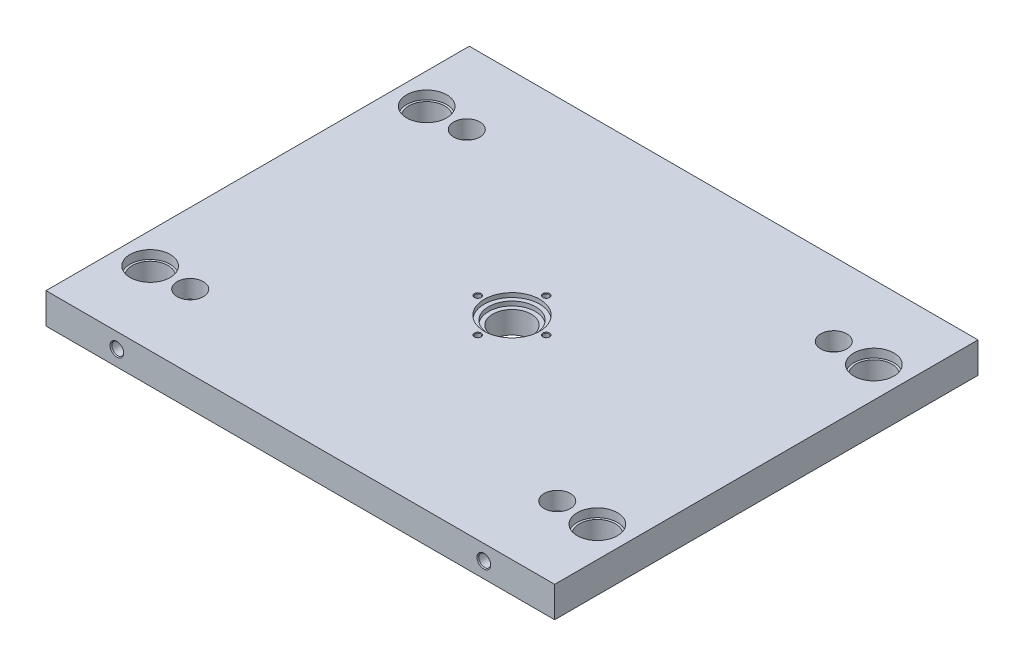
from build123d import *

# Parameters (mm, degrees)
SZKIC1_W                                           = 596
SZKIC1_H                                           = 496
SZKIC1_R                                           = 21
DODANIE_WYCI_GNI_CIE1_DEPTH                        = 36
POG_BIENIE_WALCOWE_POD_M16_WKR_T_Z_BEM_D           = 17.5
POG_BIENIE_WALCOWE_POD_M16_WKR_T_Z_BEM_CBORE_D     = 30.713
POG_BIENIE_WALCOWE_POD_M16_WKR_T_Z_BEM_CBORE_DEPTH = 21
SZKIC8_R                                           = 23.5
WYTNIJ_WYCI_GNI_CIE1_DEPTH                         = 10
SZKIC10_R                                          = 22.5
WYTNIJ_WYCI_GNI_CIE3_DEPTH                         = 777.226770989
SZKIC10_3_R                                        = 27.5
SZKIC10_3_R_2                                      = 22.5
WYTNIJ_WYCI_GNI_CIE4_DEPTH                         = 10
SZKIC10_4_R                                        = 32.5
SZKIC10_4_R_2                                      = 27.5
WYTNIJ_WYCI_GNI_CIE5_DEPTH                         = 5
OTW_R_GWINTOWANY_M161_D                            = 14
OTW_R_GWINTOWANY_M161_DEPTH                        = 42
OTW_R_GWINTOWANY_M161_CSINK_D                      = 16.05
OTW_R_GWINTOWANY_M161_CSINK_ANGLE                  = 90
OTW_R_GWINTOWANY_M161_TIP                          = 4.206024333
OTW_R_GWINTOWANY_M81_D                             = 6.8
OTW_R_GWINTOWANY_M81_DEPTH                         = 22.25
OTW_R_GWINTOWANY_M81_CSINK_D                       = 8.05
OTW_R_GWINTOWANY_M81_CSINK_ANGLE                   = 90
OTW_R_GWINTOWANY_M81_TIP                           = 2.042926105


with BuildPart() as part:
    # Szkic1 → Dodanie-wyciągnięcie1 (new body)
    with BuildSketch(Plane(origin=(0, 0, 0), x_dir=(1, 0, 0), z_dir=(0, 1, 0))):
        with Locations((298, 248)):
            Rectangle(SZKIC1_W, SZKIC1_H)
        with Locations((36, 86)):
            Circle(SZKIC1_R, mode=Mode.SUBTRACT)
        with Locations((560, 86)):
            Circle(SZKIC1_R, mode=Mode.SUBTRACT)
        with Locations((36, 410)):
            Circle(SZKIC1_R, mode=Mode.SUBTRACT)
        with Locations((560, 410)):
            Circle(SZKIC1_R, mode=Mode.SUBTRACT)
    extrude(amount=-DODANIE_WYCI_GNI_CIE1_DEPTH)

    # Pogłębienie walcowe pod M16 Wkręt z łbem sześciokątnym z gniazdem2 (through all)
    with Locations(Plane(origin=(83, 0, -410), x_dir=(0, 0, 1), z_dir=(0, 1, 0))):
        with Locations((0, 0), (0, 430), (324, 430), (324, 0)):
            CounterBoreHole(POG_BIENIE_WALCOWE_POD_M16_WKR_T_Z_BEM_D / 2, POG_BIENIE_WALCOWE_POD_M16_WKR_T_Z_BEM_CBORE_D / 2, POG_BIENIE_WALCOWE_POD_M16_WKR_T_Z_BEM_CBORE_DEPTH)

    # Szkic8 → Wytnij-wyciągnięcie1 (cut)
    with BuildSketch(Plane(origin=(0, 0, 0), x_dir=(1, 0, 0), z_dir=(0, 1, 0))):
        with Locations((36, 410)):
            Circle(SZKIC8_R)
        with Locations((560, 410)):
            Circle(SZKIC8_R)
        with Locations((560, 86)):
            Circle(SZKIC8_R)
        with Locations((36, 86)):
            Circle(SZKIC8_R)
    extrude(amount=-WYTNIJ_WYCI_GNI_CIE1_DEPTH, mode=Mode.SUBTRACT)

    # Szkic10 → Wytnij-wyciągnięcie3 (cut, through all)
    with BuildSketch(Plane(origin=(0, 0, 0), x_dir=(1, 0, 0), z_dir=(0, 1, 0))):
        with Locations((298, 248)):
            Circle(SZKIC10_R)
    extrude(amount=-WYTNIJ_WYCI_GNI_CIE3_DEPTH, mode=Mode.SUBTRACT)

    # Szkic10<3> → Wytnij-wyciągnięcie4 (cut)
    with BuildSketch(Plane(origin=(0, 0, 0), x_dir=(1, 0, 0), z_dir=(0, 1, 0))):
        with Locations((298, 248)):
            Circle(SZKIC10_3_R)
        with Locations((298, 248)):
            Circle(SZKIC10_3_R_2, mode=Mode.SUBTRACT)
    extrude(amount=-WYTNIJ_WYCI_GNI_CIE4_DEPTH, mode=Mode.SUBTRACT)

    # Szkic10<4> → Wytnij-wyciągnięcie5 (cut)
    with BuildSketch(Plane(origin=(0, 0, 0), x_dir=(1, 0, 0), z_dir=(0, 1, 0))):
        with Locations((298, 248)):
            Circle(SZKIC10_4_R)
        with Locations((298, 248)):
            Circle(SZKIC10_4_R_2, mode=Mode.SUBTRACT)
    extrude(amount=-WYTNIJ_WYCI_GNI_CIE5_DEPTH, mode=Mode.SUBTRACT)

    # Otwór gwintowany M161
    with Locations(Plane(origin=(513, -18, 0), x_dir=(1, 0, 0), z_dir=(0, 0, 1))):
        with Locations((0, 0), (-430, 0)):
            CounterSinkHole(OTW_R_GWINTOWANY_M161_D / 2, OTW_R_GWINTOWANY_M161_CSINK_D / 2, depth=OTW_R_GWINTOWANY_M161_DEPTH, counter_sink_angle=OTW_R_GWINTOWANY_M161_CSINK_ANGLE)
            with Locations((0, 0, -(OTW_R_GWINTOWANY_M161_DEPTH + OTW_R_GWINTOWANY_M161_TIP / 2))):  # 118° drill point
                Cone(0, OTW_R_GWINTOWANY_M161_D / 2, OTW_R_GWINTOWANY_M161_TIP, mode=Mode.SUBTRACT)

    # Otwór gwintowany M81
    with Locations(Plane(origin=(258, 0, -248), x_dir=(0, 0, 1), z_dir=(0, 1, 0))):
        with Locations((0, 0), (-40, 40), (0, 80), (40, 40)):
            CounterSinkHole(OTW_R_GWINTOWANY_M81_D / 2, OTW_R_GWINTOWANY_M81_CSINK_D / 2, depth=OTW_R_GWINTOWANY_M81_DEPTH, counter_sink_angle=OTW_R_GWINTOWANY_M81_CSINK_ANGLE)
            with Locations((0, 0, -(OTW_R_GWINTOWANY_M81_DEPTH + OTW_R_GWINTOWANY_M81_TIP / 2))):  # 118° drill point
                Cone(0, OTW_R_GWINTOWANY_M81_D / 2, OTW_R_GWINTOWANY_M81_TIP, mode=Mode.SUBTRACT)


solid = part.part
